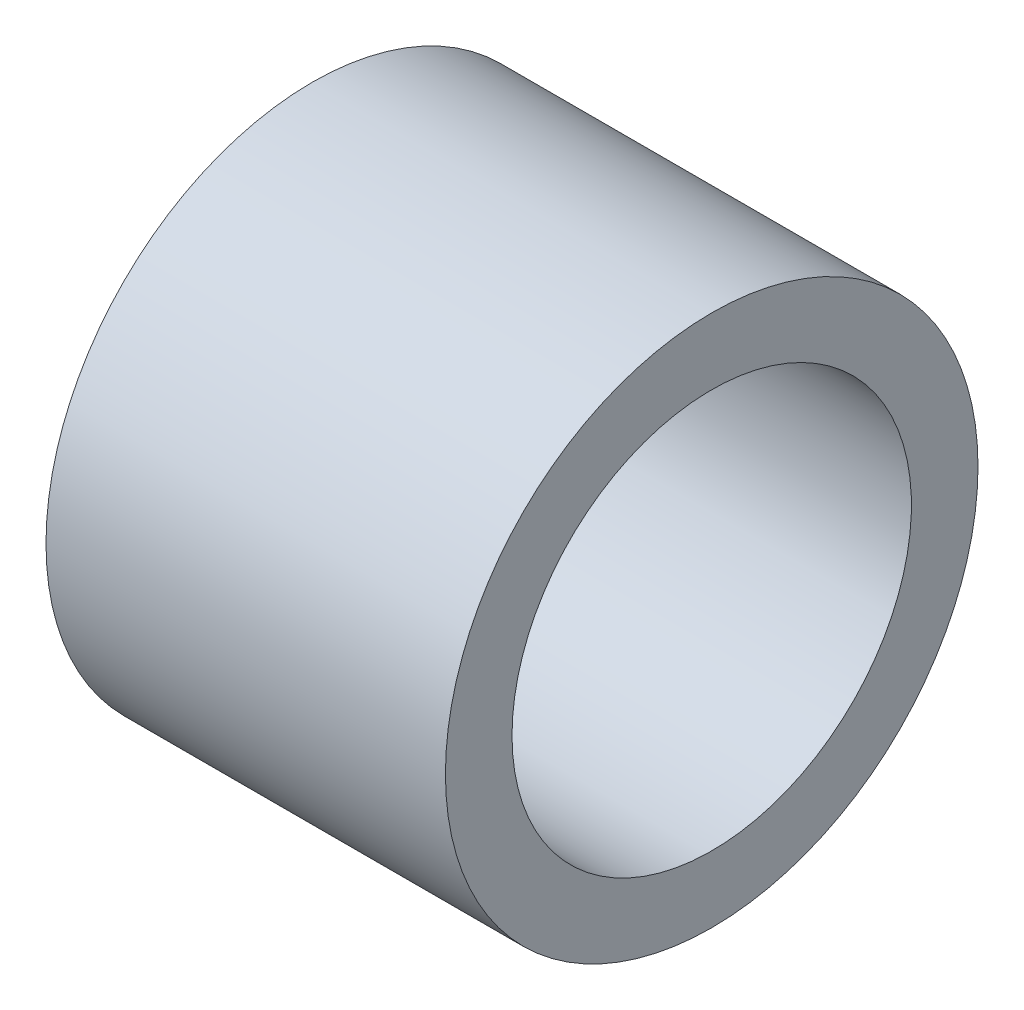
from build123d import *

# Parameters (mm, degrees)
SKETCH1_R           = 12.7
SKETCH1_R_2         = 9.525
BOSS_EXTRUDE1_DEPTH = 19.05


with BuildPart() as part:
    # Sketch1 → Boss-Extrude1 (new body)
    with BuildSketch(Plane.YZ):
        with Locations(Location((0, 0, 0), (0, 0, 90))):
            Circle(SKETCH1_R)
        with Locations(Location((0, 0, 0), (0, 0, 90))):
            Circle(SKETCH1_R_2, mode=Mode.SUBTRACT)
    extrude(amount=BOSS_EXTRUDE1_DEPTH)


solid = part.part
